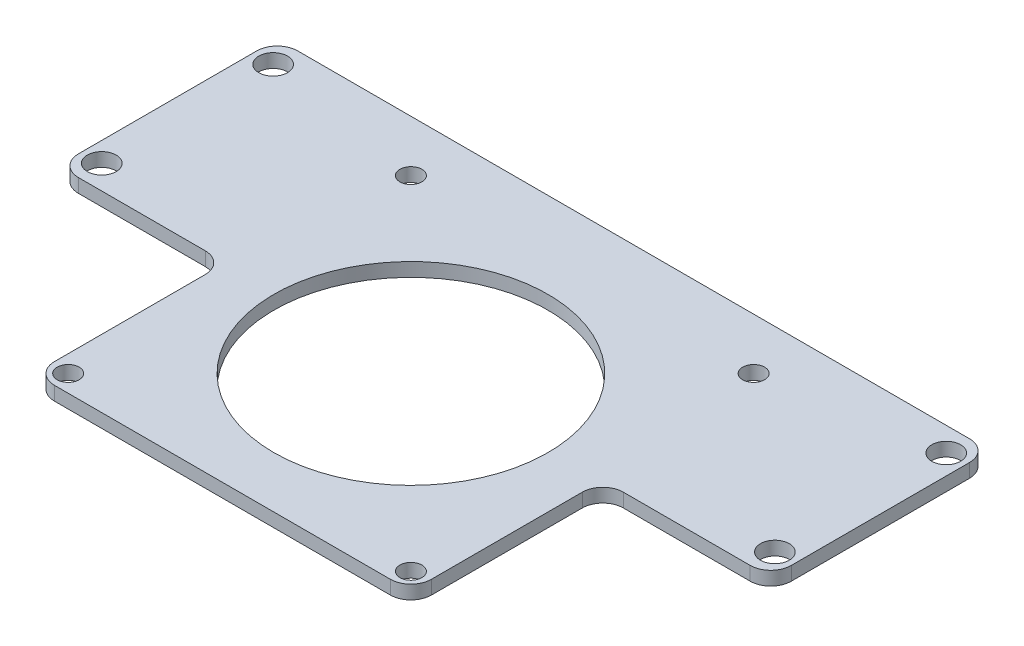
from build123d import *

# Parameters (mm, degrees)
SKETCH_1_R      = 1.6
SKETCH_1_R_2    = 20
SKETCH_1_R_3    = 2.1
EXTRUDE_1_DEPTH = 2
FILLET_1_R      = 3


with BuildPart() as part:
    # 草图1 → 凸台-拉伸1 (new body)
    with BuildSketch(Plane(origin=(0, 0, 0), x_dir=(1, 0, 0), z_dir=(0, 1, 0))):
        Polygon((52, 16), (-52, 16), (-52, -16), (-27.5, -16), (-27.5, -44), (27.5, -44), (27.5, -16), (52, -16), align=None)
        with Locations(Location((25, -41.5, 0), (0, 0, 270))):
            Circle(SKETCH_1_R, mode=Mode.SUBTRACT)
        with Locations(Location((-25, -41.5, 0), (0, 0, 270))):
            Circle(SKETCH_1_R, mode=Mode.SUBTRACT)
        with Locations(Location((0, -16.5, 0), (0, 0, 270))):
            Circle(SKETCH_1_R_2, mode=Mode.SUBTRACT)
        with Locations(Location((-49.1, -12.5, 0), (0, 0, 270))):
            Circle(SKETCH_1_R_3, mode=Mode.SUBTRACT)
        with Locations(Location((-49.1, 12.5, 0), (0, 0, 270))):
            Circle(SKETCH_1_R_3, mode=Mode.SUBTRACT)
        with Locations(Location((-25, 8.5, 0), (0, 0, 270))):
            Circle(SKETCH_1_R, mode=Mode.SUBTRACT)
        with Locations(Location((49.1, -12.5, 0), (0, 0, 270))):
            Circle(SKETCH_1_R_3, mode=Mode.SUBTRACT)
        with Locations(Location((25, 8.5, 0), (0, 0, 270))):
            Circle(SKETCH_1_R, mode=Mode.SUBTRACT)
        with Locations(Location((49.1, 12.5, 0), (0, 0, 270))):
            Circle(SKETCH_1_R_3, mode=Mode.SUBTRACT)
    extrude(amount=EXTRUDE_1_DEPTH)

    # 圆角1
    fillet_1_edges = [part.edges().sort_by_distance(p)[0] for p in [
        (27.5, 1, 44),
        (-27.5, 1, 44),
        (-27.5, 1, 16),
        (-52, 1, 16),
        (-52, 1, -16),
        (52, 1, -16),
        (52, 1, 16),
        (27.5, 1, 16),
    ]]
    fillet(fillet_1_edges, radius=FILLET_1_R)


solid = part.part
